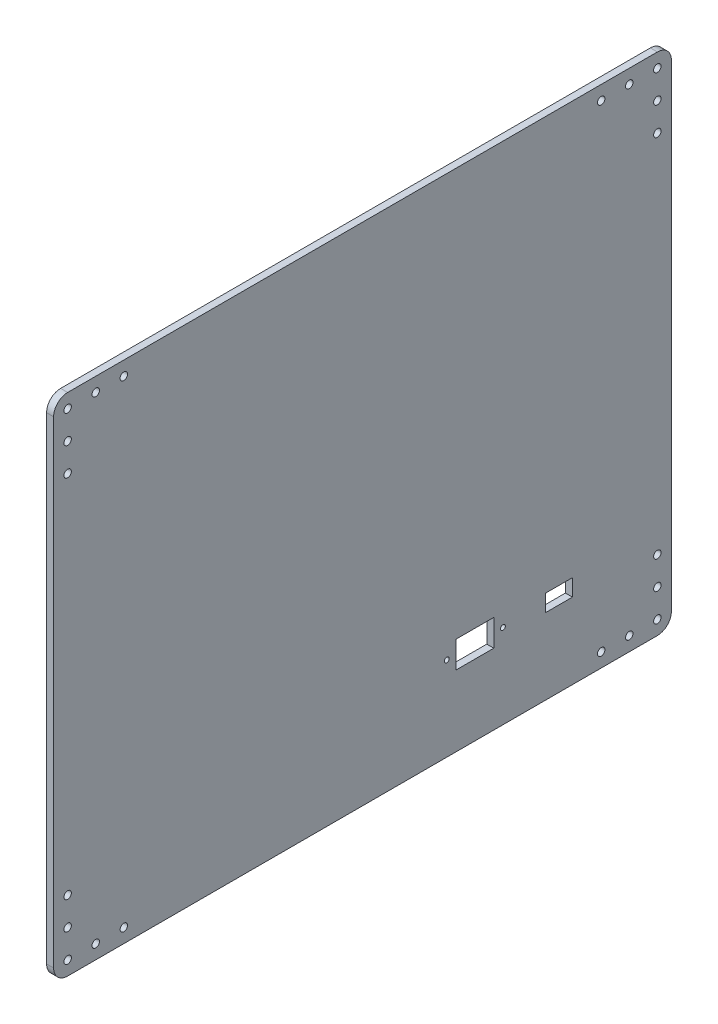
from build123d import *

# Parameters (mm, degrees)
ESBO_O1_W                 = 440
ESBO_O1_H                 = 360
RESSALTO_EXTRUS_O1_DEPTH  = 2.5
FILETE1_R                 = 10
ESBO_O2_R                 = 2.65
CORTE_EXTRUS_O1_DEPTH     = 285.297379517
ESPELHAR2_COPY_1_SKETCH_R = 2.65
ESPELHAR2_COPY_1_DEPTH    = 285.297379517
ESPELHAR2_COPY_2_SKETCH_R = 2.65
ESPELHAR2_COPY_2_DEPTH    = 285.297379517
ESBO_O3_R                 = 1.75
ESBO_O3_W                 = 27
ESBO_O3_H                 = 19
ESBO_O3_W_2               = 19
ESBO_O3_H_2               = 12
CORTE_EXTRUS_O2_DEPTH     = 285.297379517


with BuildPart() as part:
    # Esboço1 → Ressalto-extrusão1 (new, symmetric)
    with BuildSketch(Plane(origin=(0, 0, 0), x_dir=(0, 0, -1), z_dir=(1, 0, 0))):
        Rectangle(ESBO_O1_W, ESBO_O1_H)
    extrude(amount=RESSALTO_EXTRUS_O1_DEPTH, both=True)

    # Filete1
    filete1_edges = [part.edges().sort_by_distance(p)[0] for p in [
        (0, 180, -220),
        (0, -180, -220),
        (0, -180, 220),
        (0, 180, 220),
    ]]
    fillet(filete1_edges, radius=FILETE1_R)

    # Esboço2 → Corte-extrusão1 (cut, through all)
    with BuildSketch(Plane(origin=(2.5, 0, 0), x_dir=(0, 0, -1), z_dir=(1, 0, 0))):
        with Locations((-210, -170)):
            Circle(ESBO_O2_R)
        with Locations((-190, -170)):
            Circle(ESBO_O2_R)
        with Locations((-170, -170)):
            Circle(ESBO_O2_R)
        with Locations((-210, -150)):
            Circle(ESBO_O2_R)
        with Locations((-210, -130)):
            Circle(ESBO_O2_R)
    corte_extrus_o1 = extrude(amount=-CORTE_EXTRUS_O1_DEPTH, mode=Mode.SUBTRACT)

    # Espelhar1: Corte-extrusão1 across plane
    add(corte_extrus_o1.mirror(Plane.XY), mode=Mode.SUBTRACT)

    # Espelhar2 copy 1 sketch → Espelhar2 copy 1 (cut, through all)
    with BuildSketch(Plane(origin=(2.5, 0, 0), x_dir=(0, 0, 1), z_dir=(1, 0, 0))):
        with Locations((-210, -170)):
            Circle(ESPELHAR2_COPY_1_SKETCH_R)
        with Locations((-190, -170)):
            Circle(ESPELHAR2_COPY_1_SKETCH_R)
        with Locations((-170, -170)):
            Circle(ESPELHAR2_COPY_1_SKETCH_R)
        with Locations((-210, -150)):
            Circle(ESPELHAR2_COPY_1_SKETCH_R)
        with Locations((-210, -130)):
            Circle(ESPELHAR2_COPY_1_SKETCH_R)
    extrude(amount=-ESPELHAR2_COPY_1_DEPTH, mode=Mode.SUBTRACT)

    # Espelhar2 copy 2 sketch → Espelhar2 copy 2 (cut, through all)
    with BuildSketch(Plane(origin=(2.5, 0, 0), x_dir=(0, 0, -1), z_dir=(1, 0, 0))):
        with Locations((-210, 170)):
            Circle(ESPELHAR2_COPY_2_SKETCH_R)
        with Locations((-190, 170)):
            Circle(ESPELHAR2_COPY_2_SKETCH_R)
        with Locations((-170, 170)):
            Circle(ESPELHAR2_COPY_2_SKETCH_R)
        with Locations((-210, 150)):
            Circle(ESPELHAR2_COPY_2_SKETCH_R)
        with Locations((-210, 130)):
            Circle(ESPELHAR2_COPY_2_SKETCH_R)
    extrude(amount=-ESPELHAR2_COPY_2_DEPTH, mode=Mode.SUBTRACT)

    # Esboço3 → Corte-extrusão2 (cut, through all)
    with BuildSketch(Plane(origin=(2.5, 0, 0), x_dir=(0, 0, -1), z_dir=(1, 0, 0))):
        with Locations((100, -120)):
            Circle(ESBO_O3_R)
        with Locations((60, -120)):
            Circle(ESBO_O3_R)
        with Locations((80, -120)):
            Rectangle(ESBO_O3_W, ESBO_O3_H)
        with Locations((140, -120)):
            Rectangle(ESBO_O3_W_2, ESBO_O3_H_2)
    extrude(amount=-CORTE_EXTRUS_O2_DEPTH, mode=Mode.SUBTRACT)


solid = part.part
